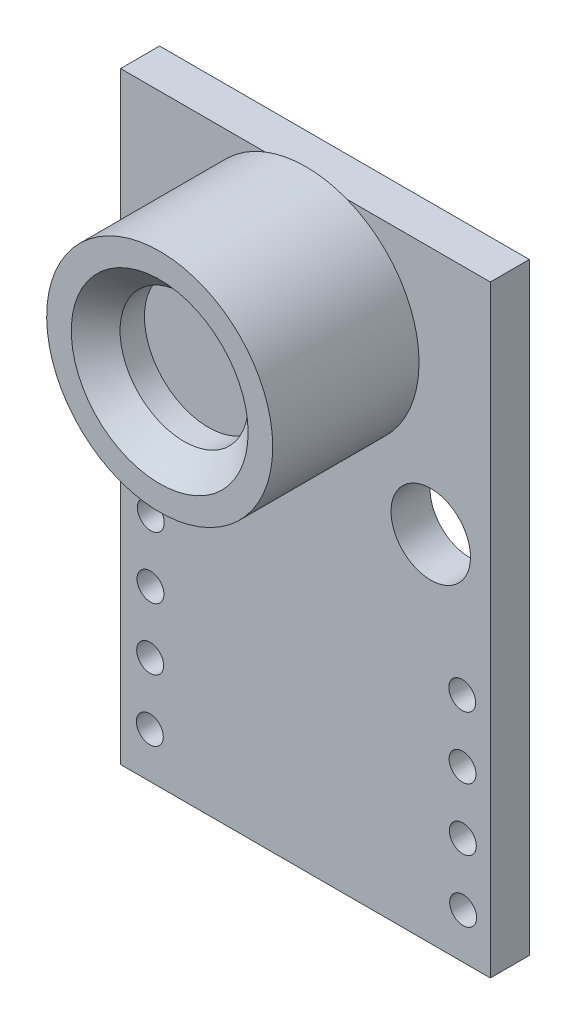
from build123d import *

# Parameters (mm, degrees)
ESQUISSE1_W             = 15.163065961
ESQUISSE1_H             = 24.718099935
ESQUISSE1_R             = 1.620437073
ESQUISSE1_R_2           = 1.629155484
ESQUISSE1_R_3           = 0.551783112
BOSS_EXTRU_1_DEPTH      = 1.6
ESQUISSE2_R             = 4.635270965
BOSS_EXTRU_2_DEPTH      = 6
ESQUISSE3_R             = 2.625763286
ENL_V_MAT_EXTRU_1_DEPTH = 2
CHANFREIN1_SIZE         = 1


with BuildPart() as part:
    # Esquisse1 → Boss.-Extru.1 (new body)
    with BuildSketch(Plane.XY):
        with Locations((7.846483978, 181.640524959)):
            Rectangle(ESQUISSE1_W, ESQUISSE1_H)
        with Locations((2.740050159, 183.860713577)):
            Circle(ESQUISSE1_R, mode=Mode.SUBTRACT)
        with Locations((12.98580948, 183.819598973)):
            Circle(ESQUISSE1_R_2, mode=Mode.SUBTRACT)
        with Locations((1.503458801, 178.757435176)):
            Circle(ESQUISSE1_R_3, mode=Mode.SUBTRACT)
        with Locations((1.490795777, 176.217466742)):
            Circle(ESQUISSE1_R_3, mode=Mode.SUBTRACT)
        with Locations((1.478132752, 173.677498307)):
            Circle(ESQUISSE1_R_3, mode=Mode.SUBTRACT)
        with Locations((1.465469727, 171.137529873)):
            Circle(ESQUISSE1_R_3, mode=Mode.SUBTRACT)
        with Locations(Location((14.313761483, 171.137529873, 0), (0, 0, 180))):
            Circle(ESQUISSE1_R_3, mode=Mode.SUBTRACT)
        with Locations(Location((14.301098459, 173.677498307, 0), (0, 0, 180))):
            Circle(ESQUISSE1_R_3, mode=Mode.SUBTRACT)
        with Locations(Location((14.288435434, 176.217466742, 0), (0, 0, 180))):
            Circle(ESQUISSE1_R_3, mode=Mode.SUBTRACT)
        with Locations(Location((14.275772409, 178.757435176, 0), (0, 0, 180))):
            Circle(ESQUISSE1_R_3, mode=Mode.SUBTRACT)
    extrude(amount=-BOSS_EXTRU_1_DEPTH)

    # Esquisse2 → Boss.-Extru.2 (add)
    with BuildSketch(Plane.XY):
        with Locations(Location((7.870027941, 189.680070203, 0), (0, 0, 111.270599652))):
            Circle(ESQUISSE2_R)
    extrude(amount=BOSS_EXTRU_2_DEPTH)

    # Esquisse3 → Enlèv. mat.-Extru.1 (cut)
    with BuildSketch(Plane.XY.offset(6)):
        with Locations((7.870027941, 189.680070203)):
            Circle(ESQUISSE3_R)
    extrude(amount=-ENL_V_MAT_EXTRU_1_DEPTH, mode=Mode.SUBTRACT)

    # Chanfrein1
    chanfrein1_edges = [part.edges().sort_by_distance(p)[0] for p in [
        (5.244264654, 189.680070203, 6),
    ]]
    chamfer(chanfrein1_edges, length=CHANFREIN1_SIZE)


solid = part.part
